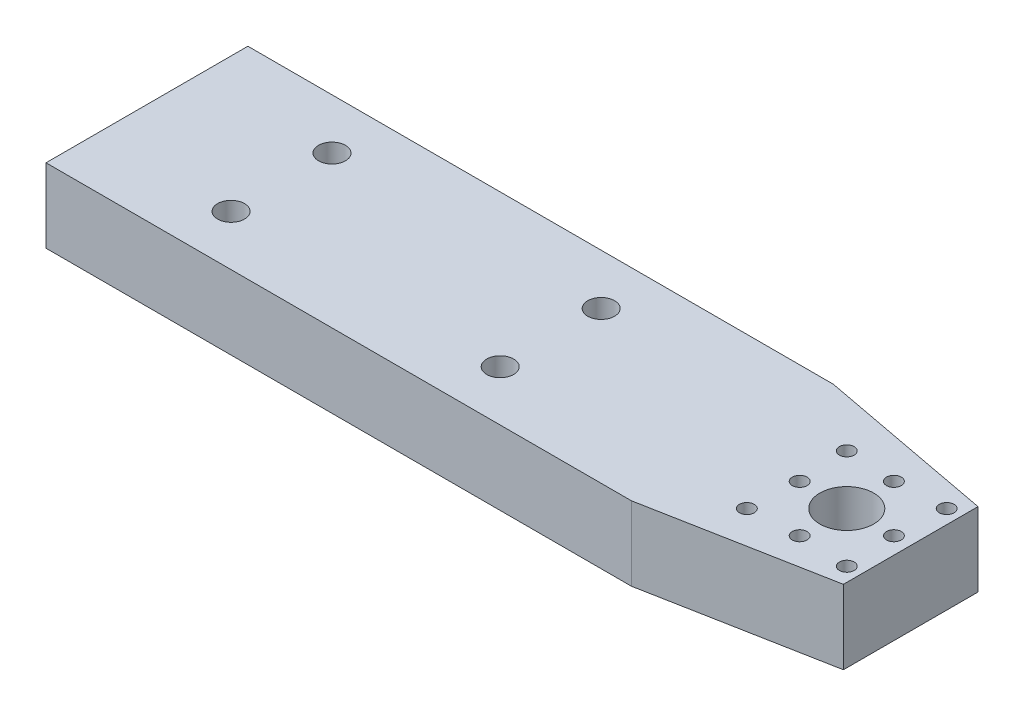
from build123d import *

# Parameters (mm, degrees)
EXTRUDE_1_DEPTH     = 11
SKETCH_2_R          = 1.5
SKETCH_2_R_2        = 4
CUT_EXTRUDE_1_DEPTH = 10
SKETCH_4_R          = 4
SKETCH_4_R_2        = 1.1
CUT_EXTRUDE_4_DEPTH = 20
SKETCH_5_W          = 18.664238265
SKETCH_5_H          = 20
CUT_EXTRUDE_5_DEPTH = 20
SKETCH_6_W          = 87
SKETCH_6_H          = 5
EXTRUDE_2_DEPTH     = 11
CUT_EXTRUDE_6_DEPTH = 11


with BuildPart() as part:
    # 草图1 → 凸台-拉伸1 (new body)
    with BuildSketch(Plane(origin=(0, 0, 0), x_dir=(1, 0, 0), z_dir=(0, 1, 0))):
        with BuildLine():
            Line((-41.199983302, 20), (78.800016698, 20))
            Line((78.800016698, 20), (78.800016698, 0))
            Line((78.800016698, 0), (-41.199983302, 0))
            ThreePointArc((-41.199983302, 0), (-51.199983302, 10), (-41.199983302, 20))
        make_face()
    extrude(amount=EXTRUDE_1_DEPTH)

    # 草图2 → 切除-拉伸1 (cut)
    with BuildSketch(Plane(origin=(0, 11, 0), x_dir=(1, 0, 0), z_dir=(0, 1, 0))):
        with Locations(Location((-48.199983302, 10, 0), (0, 0, 270))):
            Circle(SKETCH_2_R)
        with BuildLine():
            ThreePointArc((-39.699983302, 17), (-40.13932313, 18.060660172), (-41.199983302, 18.5))
            Line((-41.199983302, 18.5), (-41.199983302, 17))
            Line((-41.199983302, 17), (-41.199983302, 15.5))
            ThreePointArc((-41.199983302, 15.5), (-40.13932313, 15.939339828), (-39.699983302, 17))
        make_face()
        with BuildLine():
            Line((-41.199983302, 17), (-41.199983302, 18.5))
            ThreePointArc((-41.199983302, 18.5), (-42.699983302, 17), (-41.199983302, 15.5))
            Line((-41.199983302, 15.5), (-41.199983302, 17))
        make_face()
        with BuildLine():
            ThreePointArc((-39.699983302, 3), (-40.13932313, 4.060660172), (-41.199983302, 4.5))
            Line((-41.199983302, 4.5), (-41.199983302, 3))
            Line((-41.199983302, 3), (-41.199983302, 1.5))
            ThreePointArc((-41.199983302, 1.5), (-40.13932313, 1.939339828), (-39.699983302, 3))
        make_face()
        with BuildLine():
            Line((-41.199983302, 3), (-41.199983302, 4.5))
            ThreePointArc((-41.199983302, 4.5), (-42.699983302, 3), (-41.199983302, 1.5))
            Line((-41.199983302, 1.5), (-41.199983302, 3))
        make_face()
        with Locations(Location((-41.199983302, 10, 0), (0, 0, 270))):
            Circle(SKETCH_2_R_2)
    extrude(amount=-CUT_EXTRUDE_1_DEPTH, mode=Mode.SUBTRACT)

    # 草图4 → 切除-拉伸4 (cut)
    with BuildSketch(Plane(origin=(0, 11, 0), x_dir=(1, 0, 0), z_dir=(0, 1, 0))):
        with Locations(Location((69.300016698, 10, 0), (0, 0, 270))):
            Circle(SKETCH_4_R)
        with Locations(Location((76.7246379, 17.424621202, 0), (0, 0, 270))):
            Circle(SKETCH_4_R_2)
        with Locations(Location((62.300016698, 10, 0), (0, 0, 270))):
            Circle(SKETCH_4_R_2)
        with Locations(Location((76.7246379, 2.575378798, 0), (0, 0, 270))):
            Circle(SKETCH_4_R_2)
        with Locations(Location((61.875395496, 2.575378798, 0), (0, 0, 270))):
            Circle(SKETCH_4_R_2)
        with Locations(Location((61.875395496, 17.424621202, 0), (0, 0, 270))):
            Circle(SKETCH_4_R_2)
        with Locations(Location((69.300016698, 17, 0), (0, 0, 270))):
            Circle(SKETCH_4_R_2)
        with Locations(Location((76.300016698, 10, 0), (0, 0, 270))):
            Circle(SKETCH_4_R_2)
        with Locations(Location((69.300016698, 3, 0), (0, 0, 270))):
            Circle(SKETCH_4_R_2)
    extrude(amount=-CUT_EXTRUDE_4_DEPTH, mode=Mode.SUBTRACT)

    # 草图5 → 切除-拉伸5 (cut)
    with BuildSketch(Plane.XZ):
        with Locations((-44.032102435, -10)):
            Rectangle(SKETCH_5_W, SKETCH_5_H)
    extrude(amount=-CUT_EXTRUDE_5_DEPTH, mode=Mode.SUBTRACT)

    # 草图6 → 凸台-拉伸2 (add)
    with BuildSketch(Plane(origin=(0, 11, 0), x_dir=(1, 0, 0), z_dir=(0, 1, 0))):
        Polygon((78.800016698, 20), (52.300016698, 25), (52.300016698, 20), align=None)
        Polygon((78.800016698, 0), (52.300016698, 0), (52.300016698, -5), align=None)
        with Locations((8.800016698, 22.5)):
            Rectangle(SKETCH_6_W, SKETCH_6_H)
        with Locations((8.800016698, -2.5)):
            Rectangle(SKETCH_6_W, SKETCH_6_H)
    extrude(amount=-EXTRUDE_2_DEPTH)

    # 草图7 → 切除-拉伸6 (cut)
    with BuildSketch(Plane(origin=(0, 11, 0), x_dir=(1, 0, 0), z_dir=(0, 1, 0))):
        with BuildLine():
            Line((23.300016698, 17.5), (25.300016698, 17.5))
            Line((25.300016698, 17.5), (25.300016698, 15.5))
            ThreePointArc((25.300016698, 15.5), (26.71423026, 16.085786438), (27.300016698, 17.5))
            ThreePointArc((27.300016698, 17.5), (25.300016698, 19.5), (23.300016698, 17.5))
        make_face()
        with BuildLine():
            Line((25.300016698, 15.5), (25.300016698, 17.5))
            Line((25.300016698, 17.5), (23.300016698, 17.5))
            ThreePointArc((23.300016698, 17.5), (23.885803136, 16.085786438), (25.300016698, 15.5))
        make_face()
        with BuildLine():
            ThreePointArc((27.300016698, 2.5), (26.71423026, 3.914213562), (25.300016698, 4.5))
            Line((25.300016698, 4.5), (25.300016698, 2.5))
            Line((25.300016698, 2.5), (23.300016698, 2.5))
            ThreePointArc((23.300016698, 2.5), (25.300016698, 0.5), (27.300016698, 2.5))
        make_face()
        with BuildLine():
            Line((25.300016698, 2.5), (25.300016698, 4.5))
            ThreePointArc((25.300016698, 4.5), (23.885803136, 3.914213562), (23.300016698, 2.5))
            Line((23.300016698, 2.5), (25.300016698, 2.5))
        make_face()
        with BuildLine():
            ThreePointArc((-14.699983302, 15.5), (-13.28576974, 16.085786438), (-12.699983302, 17.5))
            Line((-12.699983302, 17.5), (-14.699983302, 17.5))
            Line((-14.699983302, 17.5), (-14.699983302, 15.5))
        make_face()
        with BuildLine():
            Line((-14.699983302, 17.5), (-12.699983302, 17.5))
            ThreePointArc((-12.699983302, 17.5), (-16.114196864, 18.914213562), (-14.699983302, 15.5))
            Line((-14.699983302, 15.5), (-14.699983302, 17.5))
        make_face()
        with BuildLine():
            ThreePointArc((-14.699983302, 4.5), (-16.114196864, 1.085786438), (-12.699983302, 2.5))
            Line((-12.699983302, 2.5), (-14.699983302, 2.5))
            Line((-14.699983302, 2.5), (-14.699983302, 4.5))
        make_face()
        with BuildLine():
            Line((-14.699983302, 2.5), (-12.699983302, 2.5))
            ThreePointArc((-12.699983302, 2.5), (-13.28576974, 3.914213562), (-14.699983302, 4.5))
            Line((-14.699983302, 4.5), (-14.699983302, 2.5))
        make_face()
    extrude(amount=-CUT_EXTRUDE_6_DEPTH, mode=Mode.SUBTRACT)


solid = part.part
